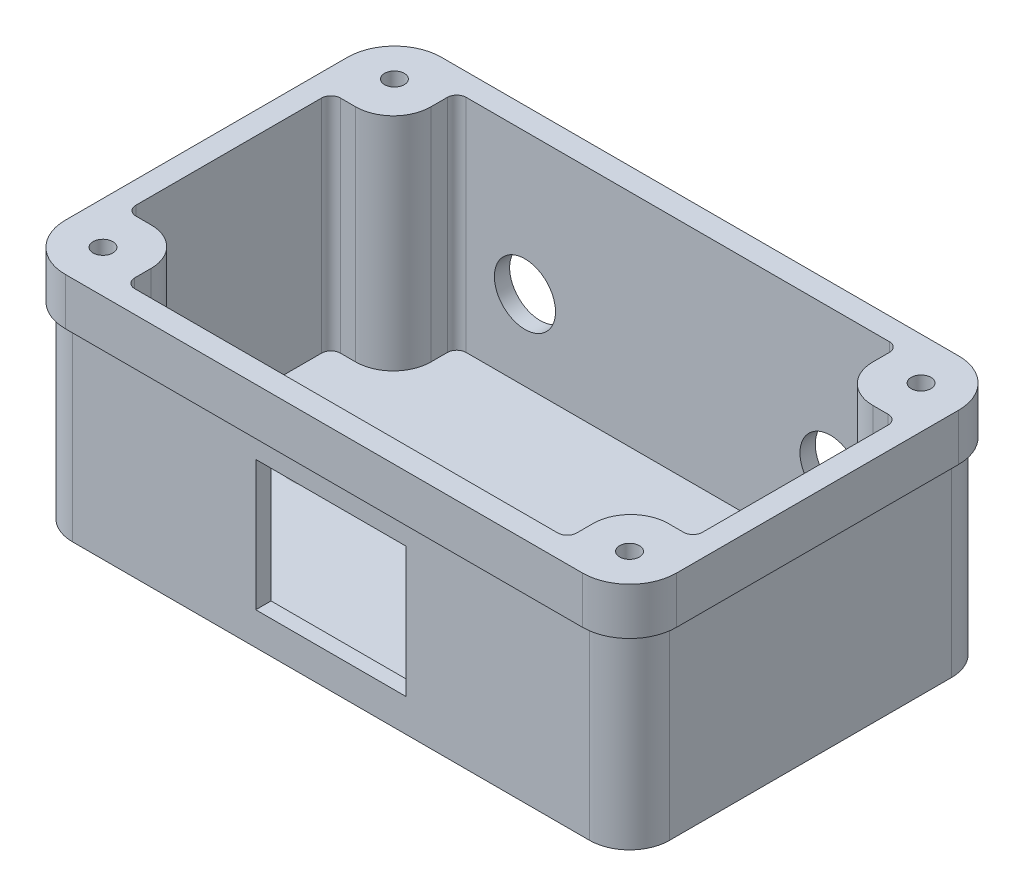
from build123d import *

# Parameters (mm, degrees)
BOSS_EXTRUDE1_DEPTH = 50
SHELL1_T            = -3
CUT_EXTRUDE1_DEPTH  = 40
SKETCH3_R           = 2.1
BOSS_EXTRUDE5_DEPTH = 47
SKETCH5_R           = 2
CUT_EXTRUDE2_DEPTH  = 10
BOSS_EXTRUDE6_START = 3
SKETCH6_R           = 6
SKETCH6_R_2         = 2
BOSS_EXTRUDE6_DEPTH = 3
FILLET1_R           = 1
SKETCH7_W           = 32
SKETCH7_H           = 27.7
CUT_EXTRUDE3_DEPTH  = 10
SKETCH8_R           = 6.5
CUT_EXTRUDE4_DEPTH  = 10


with BuildPart() as part:
    # Sketch1 → Boss-Extrude1 (new body)
    with BuildSketch(Plane(origin=(0, 0, 0), x_dir=(1, 0, 0), z_dir=(0, 1, 0))):
        with BuildLine():
            Line((-55, 40), (55, 40))
            ThreePointArc((55, 40), (62.071067812, 37.071067812), (65, 30))
            Line((65, 30), (65, -30))
            ThreePointArc((65, -30), (62.071067812, -37.071067812), (55, -40))
            Line((55, -40), (-55, -40))
            ThreePointArc((-55, -40), (-62.071067812, -37.071067812), (-65, -30))
            Line((-65, -30), (-65, 30))
            ThreePointArc((-65, 30), (-62.071067812, 37.071067812), (-55, 40))
        make_face()
    extrude(amount=BOSS_EXTRUDE1_DEPTH)

    # Shell1
    shell1_openings = [part.faces().sort_by_distance(p)[0] for p in [
        (0, 50, 0),
    ]]
    offset(amount=SHELL1_T, openings=shell1_openings, kind=Kind.INTERSECTION)

    # Sketch2 → Cut-Extrude1 (cut)
    with BuildSketch(Plane.XZ):
        with BuildLine():
            Line((65, -30), (65, 30))
            ThreePointArc((65, 30), (62.071067812, 37.071067812), (55, 40))
            Line((55, 40), (-55, 40))
            ThreePointArc((-55, 40), (-62.071067812, 37.071067812), (-65, 30))
            Line((-65, 30), (-65, -30))
            ThreePointArc((-65, -30), (-62.071067812, -37.071067812), (-55, -40))
            Line((-55, -40), (55, -40))
            ThreePointArc((55, -40), (62.071067812, -37.071067812), (65, -30))
        make_face()
        with BuildLine():
            Line((-63.5, 30), (-63.5, -30))
            ThreePointArc((-63.5, -30), (-61.01040764, -36.01040764), (-55, -38.5))
            Line((-55, -38.5), (55, -38.5))
            ThreePointArc((55, -38.5), (61.01040764, -36.01040764), (63.5, -30))
            Line((63.5, -30), (63.5, 30))
            ThreePointArc((63.5, 30), (61.01040764, 36.01040764), (55, 38.5))
            Line((55, 38.5), (-55, 38.5))
            ThreePointArc((-55, 38.5), (-61.01040764, 36.01040764), (-63.5, 30))
        make_face(mode=Mode.SUBTRACT)
    extrude(amount=-CUT_EXTRUDE1_DEPTH, mode=Mode.SUBTRACT)

    # Sketch5 → Cut-Extrude2 (cut)
    with BuildSketch(Plane(origin=(0, 3, 0), x_dir=(1, 0, 0), z_dir=(0, 1, 0))):
        with Locations(Location((-40, 0, 0), (0, 0, 270))):
            Circle(SKETCH5_R)
        with Locations(Location((40, 0, 0), (0, 0, 270))):
            Circle(SKETCH5_R)
    extrude(amount=-CUT_EXTRUDE2_DEPTH, mode=Mode.SUBTRACT)


with BuildPart() as body_2:
    # Sketch3 → Boss-Extrude5 (new body)
    with BuildSketch(Plane(origin=(0, 3, 0), x_dir=(1, 0, 0), z_dir=(0, 1, 0))):
        with BuildLine():
            Line((62, -30), (62, 30))
            ThreePointArc((62, 30), (59.949747468, 34.949747468), (55, 37))
            Line((55, 37), (-55, 37))
            ThreePointArc((-55, 37), (-59.949747468, 34.949747468), (-62, 30))
            Line((-62, 30), (-62, -30))
            ThreePointArc((-62, -30), (-59.949747468, -34.949747468), (-55, -37))
            Line((-55, -37), (55, -37))
            ThreePointArc((55, -37), (59.949747468, -34.949747468), (62, -30))
        make_face()
        with Locations(Location((-56, 31, 0), (0, 0, 270))):
            Circle(SKETCH3_R, mode=Mode.SUBTRACT)
        with Locations(Location((56, 31, 0), (0, 0, 90))):
            Circle(SKETCH3_R, mode=Mode.SUBTRACT)
        with Locations(Location((56, -31, 0), (0, 0, 270))):
            Circle(SKETCH3_R, mode=Mode.SUBTRACT)
        with Locations(Location((-56, -31, 0), (0, 0, 90))):
            Circle(SKETCH3_R, mode=Mode.SUBTRACT)
        with BuildLine():
            Line((-58.25, 21.75), (-55, 21.75))
            ThreePointArc((-55, 21.75), (-49.343145751, 24.093145751), (-47, 29.75))
            Line((-47, 29.75), (-47, 33.25))
            ThreePointArc((-47, 33.25), (-46.414213562, 34.664213562), (-45, 35.25))
            Line((-45, 35.25), (45, 35.25))
            ThreePointArc((45, 35.25), (46.414213562, 34.664213562), (47, 33.25))
            Line((47, 33.25), (47, 29.75))
            ThreePointArc((47, 29.75), (49.343145751, 24.093145751), (55, 21.75))
            Line((55, 21.75), (58.25, 21.75))
            ThreePointArc((58.25, 21.75), (59.664213562, 21.164213562), (60.25, 19.75))
            Line((60.25, 19.75), (60.25, -19.75))
            ThreePointArc((60.25, -19.75), (59.664213562, -21.164213562), (58.25, -21.75))
            Line((58.25, -21.75), (55, -21.75))
            ThreePointArc((55, -21.75), (49.343145751, -24.093145751), (47, -29.75))
            Line((47, -29.75), (47, -33.25))
            ThreePointArc((47, -33.25), (46.414213562, -34.664213562), (45, -35.25))
            Line((45, -35.25), (-45, -35.25))
            ThreePointArc((-45, -35.25), (-46.414213562, -34.664213562), (-47, -33.25))
            Line((-47, -33.25), (-47, -29.75))
            ThreePointArc((-47, -29.75), (-49.343145751, -24.093145751), (-55, -21.75))
            Line((-55, -21.75), (-58.25, -21.75))
            ThreePointArc((-58.25, -21.75), (-59.664213562, -21.164213562), (-60.25, -19.75))
            Line((-60.25, -19.75), (-60.25, 19.75))
            ThreePointArc((-60.25, 19.75), (-59.664213562, 21.164213562), (-58.25, 21.75))
        make_face(mode=Mode.SUBTRACT)
    extrude(amount=BOSS_EXTRUDE5_DEPTH)


    add(part.part)  # Boss-Extrude6 merges part
    # Sketch6 → Boss-Extrude6 (add)
    # profile 1 of 2: a face of its own
    with BuildSketch(Plane(origin=(0, 3, 0), x_dir=(1, 0, 0), z_dir=(0, 1, 0)).offset(BOSS_EXTRUDE6_START)):
        with Locations(Location((-40, 0, 0), (0, 0, 270))):
            Circle(SKETCH6_R)
        with Locations(Location((-40, 0, 0), (0, 0, 270))):
            Circle(SKETCH6_R_2, mode=Mode.SUBTRACT)
    # profile 2 of 2: a face of its own
    with BuildSketch(Plane(origin=(0, 3, 0), x_dir=(1, 0, 0), z_dir=(0, 1, 0)).offset(BOSS_EXTRUDE6_START)):
        with Locations(Location((40, 0, 0), (0, 0, 90))):
            Circle(SKETCH6_R)
        with Locations(Location((40, 0, 0), (0, 0, 270))):
            Circle(SKETCH6_R_2, mode=Mode.SUBTRACT)
    extrude(amount=-BOSS_EXTRUDE6_DEPTH)

    # Fillet1
    fillet1_edges = [body_2.edges().sort_by_distance(p)[0] for p in [
        (-40, 6, -6),
        (-40, 3, -6),
        (40, 6, 6),
        (40, 3, 6),
    ]]
    fillet(fillet1_edges, radius=FILLET1_R)

    # Sketch7 → Cut-Extrude3 (cut)
    with BuildSketch(Plane.XY.offset(38.5)):
        with Locations((0, 20.830272727)):
            Rectangle(SKETCH7_W, SKETCH7_H)
    extrude(amount=-CUT_EXTRUDE3_DEPTH, mode=Mode.SUBTRACT)

    # Sketch8 → Cut-Extrude4 (cut)
    with BuildSketch(Plane(origin=(0, 0, -38.5), x_dir=(-1, 0, 0), z_dir=(0, 0, -1))):
        with Locations((-32.5, 20)):
            Circle(SKETCH8_R)
        with Locations(Location((32.5, 20, 0), (0, 0, 180))):
            Circle(SKETCH8_R)
    extrude(amount=-CUT_EXTRUDE4_DEPTH, mode=Mode.SUBTRACT)


solid = body_2.part
